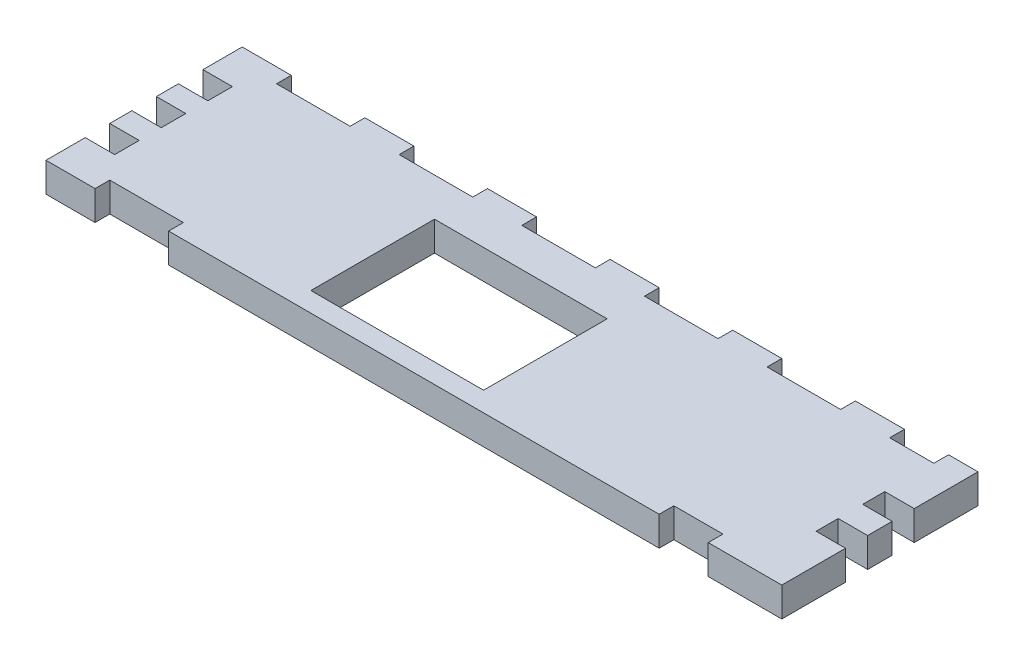
from build123d import *

# Parameters (mm, degrees)
SKETCH_1_W             = 150
SKETCH_1_H             = 36
EXTRUDE_2_DEPTH        = 6
SKETCH_6_W             = 10
SKETCH_6_H             = 6
EXTRUDE_4_DEPTH        = 4
PATTERN_LINEAR_1_COUNT = 6
PATTERN_LINEAR_1_PITCH = 25
SKETCH_8_W             = 5
SKETCH_8_H             = 6
SKETCH_8_W_2           = 4.995224333
CUT_EXTRUDE_3_DEPTH    = 6
SKETCH_11_W            = 4.504775667
SKETCH_11_H            = 6
SKETCH_11_W_2          = 4.5
CUT_EXTRUDE_4_DEPTH    = 6
SKETCH_12_W            = 35.2
SKETCH_12_H            = 25.2
CUT_EXTRUDE_5_DEPTH    = 155.376163963
SKETCH_14_W            = 15
SKETCH_14_H            = 6
SKETCH_14_W_2          = 10
CUT_EXTRUDE_6_DEPTH    = 4
SKETCH_15_W            = 15
SKETCH_15_H            = 6
EXTRUDE_5_DEPTH        = 1
PATTERN_LINEAR_2_COUNT = 5
PATTERN_LINEAR_2_PITCH = 25
SKETCH_16_W            = 15
SKETCH_16_H            = 6
EXTRUDE_6_DEPTH        = 1
SKETCH_17_W            = 10
SKETCH_17_H            = 6
EXTRUDE_7_DEPTH        = 1
SKETCH_18_W            = 15
SKETCH_18_H            = 6
EXTRUDE_8_DEPTH        = 1
SKETCH_19_W            = 6
SKETCH_19_H            = 6
EXTRUDE_9_DEPTH        = 3


with BuildPart() as part:
    # Эскиз1 → Бобышка-Вытянуть2 (new body)
    with BuildSketch(Plane(origin=(0, 0, 0), x_dir=(1, 0, 0), z_dir=(0, 1, 0))):
        with Locations((75, -18)):
            Rectangle(SKETCH_1_W, SKETCH_1_H)
    extrude(amount=EXTRUDE_2_DEPTH)

    # Эскиз6 → Бобышка-Вытянуть4 (add)
    with BuildSketch(Plane(origin=(0, 0, 0), x_dir=(-1, 0, 0), z_dir=(0, 0, -1))):
        with Locations((-5, 3)):
            Rectangle(SKETCH_6_W, SKETCH_6_H)
    extrude_4 = extrude(amount=EXTRUDE_4_DEPTH)

    # Линейный массив1: Бобышка-Вытянуть4 ×6
    with Locations(*[(i * PATTERN_LINEAR_1_PITCH, 0, 0) for i in range(1, PATTERN_LINEAR_1_COUNT)]):
        add(extrude_4)

    # Эскиз8 → Вырез-Вытянуть3 (cut)
    with BuildSketch(Plane.ZY):
        with Locations((6.5, 3)):
            Rectangle(SKETCH_8_W, SKETCH_8_H)
        with Locations((16, 3)):
            Rectangle(SKETCH_8_W, SKETCH_8_H)
        with Locations((25.502387834, 3)):
            Rectangle(SKETCH_8_W_2, SKETCH_8_H)
    extrude(amount=-CUT_EXTRUDE_3_DEPTH, mode=Mode.SUBTRACT)

    # Эскиз11 → Вырез-Вытянуть4 (cut)
    with BuildSketch(Plane(origin=(150, 0, 0), x_dir=(0, 0, -1), z_dir=(1, 0, 0))):
        with Locations((-20.752387834, 3)):
            Rectangle(SKETCH_11_W, SKETCH_11_H)
        with Locations((-11.25, 3)):
            Rectangle(SKETCH_11_W_2, SKETCH_11_H)
    extrude(amount=-CUT_EXTRUDE_4_DEPTH, mode=Mode.SUBTRACT)

    # Эскиз12 → Вырез-Вытянуть5 (cut, through all)
    with BuildSketch(Plane(origin=(0, 6, 0), x_dir=(1, 0, 0), z_dir=(0, 1, 0))):
        with Locations((67.6, -19.4)):
            Rectangle(SKETCH_12_W, SKETCH_12_H)
    extrude(amount=-CUT_EXTRUDE_5_DEPTH, mode=Mode.SUBTRACT)

    # Эскиз14 → Вырез-Вытянуть6 (cut)
    with BuildSketch(Plane.XY.offset(36)):
        with Locations((17.5, 3)):
            Rectangle(SKETCH_14_W, SKETCH_14_H)
        with Locations((130, 3)):
            Rectangle(SKETCH_14_W_2, SKETCH_14_H)
    extrude(amount=-CUT_EXTRUDE_6_DEPTH, mode=Mode.SUBTRACT)

    # Эскиз15 → Бобышка-Вытянуть5 (add)
    with BuildSketch(Plane(origin=(0, 0, 0), x_dir=(-1, 0, 0), z_dir=(0, 0, -1))):
        with Locations((-17.5, 3)):
            Rectangle(SKETCH_15_W, SKETCH_15_H)
    extrude_5 = extrude(amount=EXTRUDE_5_DEPTH)

    # Линейный массив2: Бобышка-Вытянуть5 ×5
    with Locations(*[(i * PATTERN_LINEAR_2_PITCH, 0, 0) for i in range(1, PATTERN_LINEAR_2_COUNT)]):
        add(extrude_5)

    # Эскиз16 → Бобышка-Вытянуть6 (add)
    with BuildSketch(Plane(origin=(0, 0, 0), x_dir=(-1, 0, 0), z_dir=(0, 0, -1))):
        with Locations((-142.5, 3)):
            Rectangle(SKETCH_16_W, SKETCH_16_H)
    extrude(amount=EXTRUDE_6_DEPTH)

    # Эскиз17 → Бобышка-Вытянуть7 (add)
    with BuildSketch(Plane.XY.offset(32)):
        with Locations((130, 3)):
            Rectangle(SKETCH_17_W, SKETCH_17_H)
    extrude(amount=EXTRUDE_7_DEPTH)

    # Эскиз18 → Бобышка-Вытянуть8 (add)
    with BuildSketch(Plane.XY.offset(32)):
        with Locations((17.5, 3)):
            Rectangle(SKETCH_18_W, SKETCH_18_H)
    extrude(amount=EXTRUDE_8_DEPTH)

    # Эскиз19 → Бобышка-Вытянуть9 (add)
    with BuildSketch(Plane(origin=(0, 0, -1), x_dir=(-1, 0, 0), z_dir=(0, 0, -1))):
        with Locations((-147, 3)):
            Rectangle(SKETCH_19_W, SKETCH_19_H)
    extrude(amount=EXTRUDE_9_DEPTH)


solid = part.part
